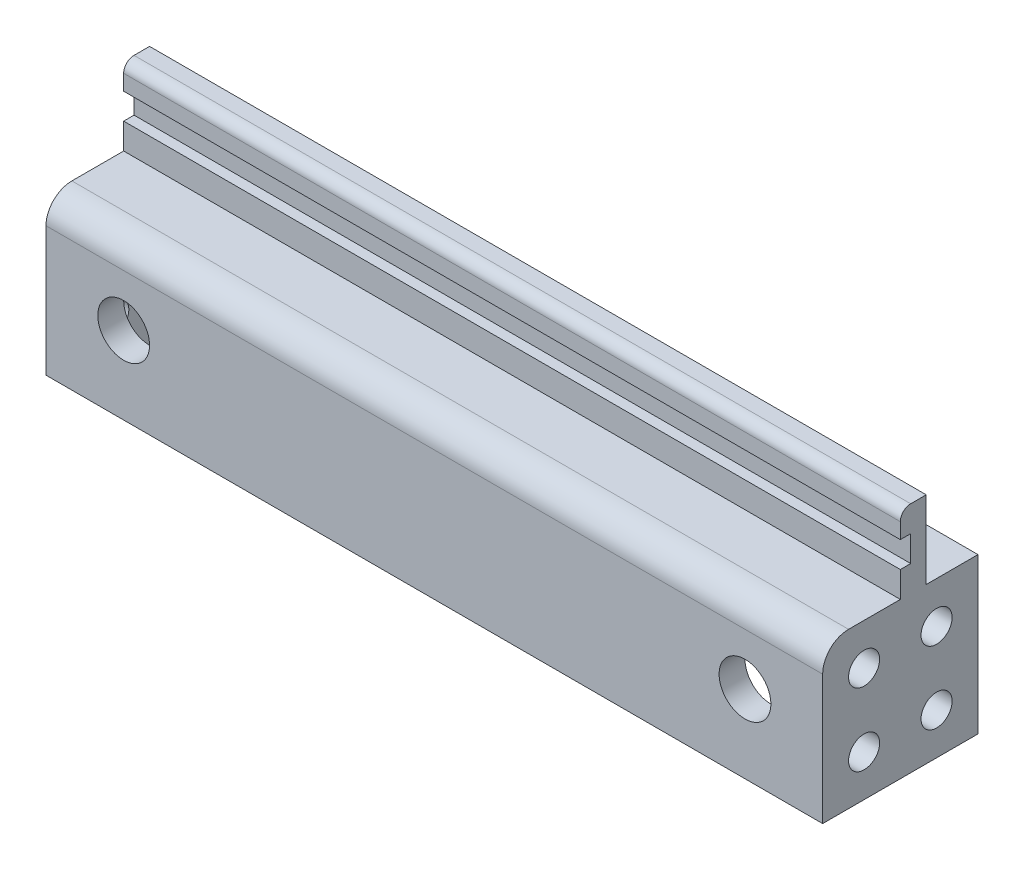
from build123d import *

# Parameters (mm, degrees)
SKETCH2_W               = 150
SKETCH2_H               = 30
BOSS_EXTRUDE1_DEPTH     = 30
SHELL1_T                = -5
CUT_EXTRUDE1_DEPTH      = 156.884572681
CUT_EXTRUDE1_DEPTH_BACK = 156.884572681
SKETCH3_R               = 3
CUT_EXTRUDE2_DEPTH      = 156.884572681
CUT_EXTRUDE2_DEPTH_BACK = 156.884572681
SKETCH5_R               = 5
SKETCH6_W               = 150
SKETCH6_H               = 5
BOSS_EXTRUDE3_DEPTH     = 15
SKETCH7_W               = 150
SKETCH7_H               = 5
CUT_EXTRUDE3_DEPTH      = 2
FILLET1_R               = 2
FILLET2_R               = 5


with BuildPart() as part:
    # Sketch2 → Boss-Extrude1 (new body)
    with BuildSketch(Plane(origin=(0, 0, 0), x_dir=(1, 0, 0), z_dir=(0, 1, 0))):
        with Locations((-75, 15)):
            Rectangle(SKETCH2_W, SKETCH2_H)
    extrude(amount=BOSS_EXTRUDE1_DEPTH)

    # Shell1
    shell1_openings = [part.faces().sort_by_distance(p)[0] for p in [
        (-75, 0, -15),
    ]]
    offset(amount=SHELL1_T, openings=shell1_openings, kind=Kind.INTERSECTION)

    # Sketch3 → Cut-Extrude1 (cut, two sides: drawn at the far end of the back side and taken through both)
    with BuildSketch(Plane.ZY.offset(150).offset(-CUT_EXTRUDE1_DEPTH_BACK)):
        with Locations(Location((-22, 22, 0), (0, 0, 180))):
            Circle(SKETCH3_R)
        with Locations((-8, 22)):
            Circle(SKETCH3_R)
        with Locations((-8, 8)):
            Circle(SKETCH3_R)
        with Locations(Location((-22, 8, 0), (0, 0, 180))):
            Circle(SKETCH3_R)
    extrude(amount=CUT_EXTRUDE1_DEPTH + CUT_EXTRUDE1_DEPTH_BACK, mode=Mode.SUBTRACT)

    # Sketch5 → Cut-Extrude2 (cut, two sides: drawn at the far end of the back side and taken through both)
    with BuildSketch(Plane.XY.offset(-CUT_EXTRUDE2_DEPTH_BACK)):
        with Locations(Location((-135, 15, 0), (0, 0, 180))):
            Circle(SKETCH5_R)
        with Locations(Location((-15, 15, 0), (0, 0, 180))):
            Circle(SKETCH5_R)
    extrude(amount=CUT_EXTRUDE2_DEPTH + CUT_EXTRUDE2_DEPTH_BACK, mode=Mode.SUBTRACT)

    # Sketch6 → Boss-Extrude3 (add)
    with BuildSketch(Plane(origin=(0, 30, 0), x_dir=(1, 0, 0), z_dir=(0, 1, 0))):
        with Locations((-75, 17.5)):
            Rectangle(SKETCH6_W, SKETCH6_H)
    extrude(amount=BOSS_EXTRUDE3_DEPTH)

    # Sketch7 → Cut-Extrude3 (cut)
    with BuildSketch(Plane.XY.offset(-15)):
        with Locations((-75, 37.5)):
            Rectangle(SKETCH7_W, SKETCH7_H)
    extrude(amount=-CUT_EXTRUDE3_DEPTH, mode=Mode.SUBTRACT)

    # Fillet1
    fillet1_edges = [part.edges().sort_by_distance(p)[0] for p in [
        (-75, 45, -15),
    ]]
    fillet(fillet1_edges, radius=FILLET1_R)

    # Fillet2
    fillet2_edges = [part.edges().sort_by_distance(p)[0] for p in [
        (-75, 30, 0),
    ]]
    fillet(fillet2_edges, radius=FILLET2_R)


solid = part.part
